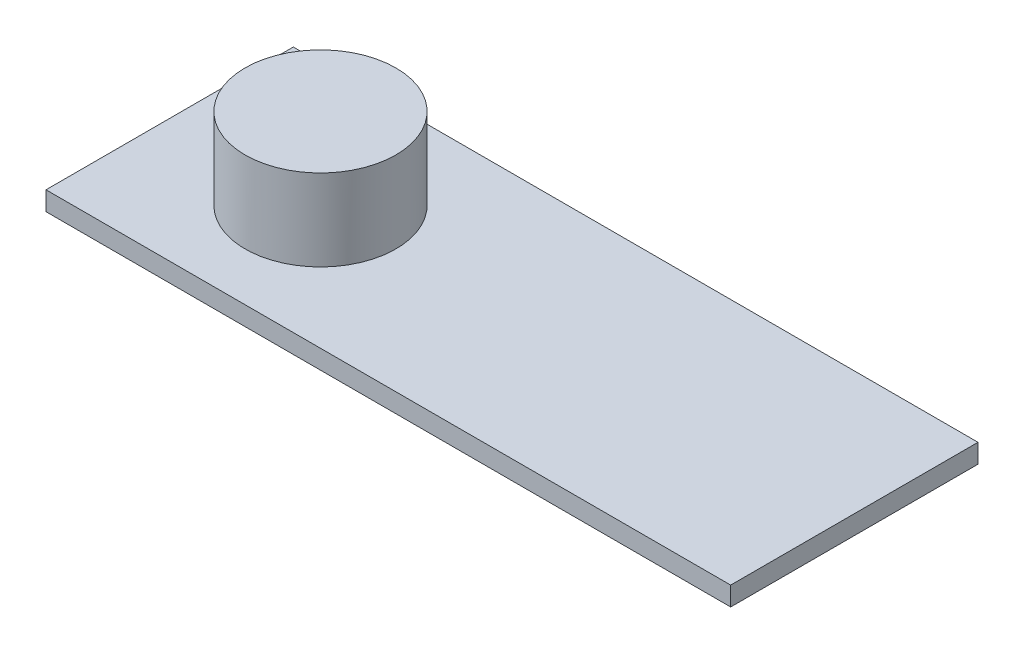
from build123d import *

# Parameters (mm, degrees)
SKETCH1_W           = 57.658
SKETCH1_H           = 20.828
BOSS_EXTRUDE1_DEPTH = 1.6
SKETCH2_R           = 6.35
BOSS_EXTRUDE2_DEPTH = 6.858


with BuildPart() as part:
    # Sketch1 → Boss-Extrude1 (new body)
    with BuildSketch(Plane(origin=(0, 0, 0), x_dir=(1, 0, 0), z_dir=(0, 1, 0))):
        Rectangle(SKETCH1_W, SKETCH1_H)
    extrude(amount=BOSS_EXTRUDE1_DEPTH)

    # Sketch2 → Boss-Extrude2 (add)
    with BuildSketch(Plane(origin=(0, 1.6, 0), x_dir=(1, 0, 0), z_dir=(0, 1, 0))):
        with Locations(Location((-16.129, 0, 0), (0, 0, 90))):
            Circle(SKETCH2_R)
    extrude(amount=BOSS_EXTRUDE2_DEPTH)


solid = part.part
